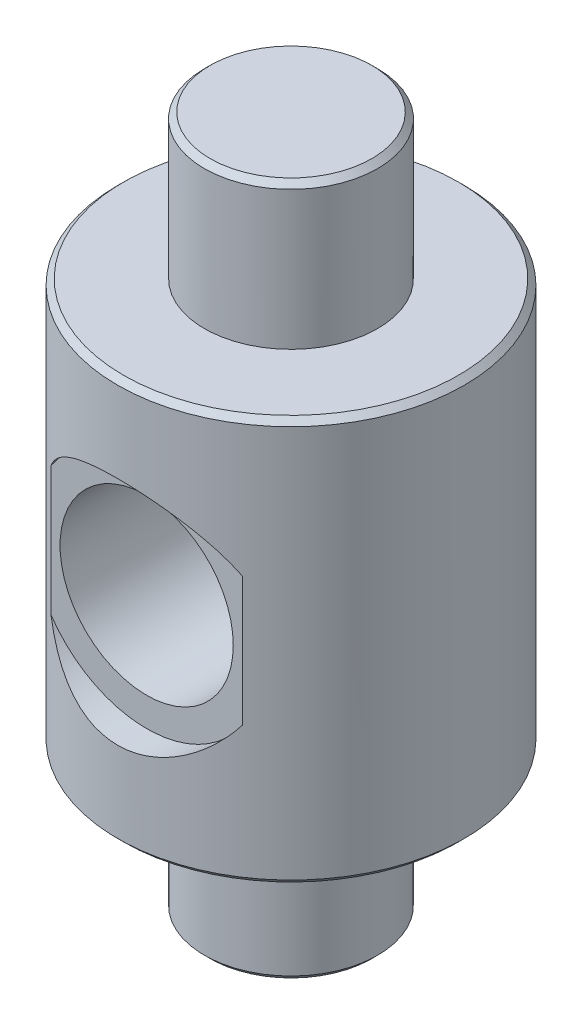
from build123d import *

# Parameters (mm, degrees)
SKETCH2_R          = 2
CUT_EXTRUDE1_DEPTH = 0.5
SKETCH3_R          = 1.5
CUT_EXTRUDE2_DEPTH = 14.536986433
CHAMFER1_SIZE      = 0.1


with BuildPart() as part:
    # Sketch1 → Revolve1 (revolve)
    with BuildSketch(Plane.XY, mode=Mode.PRIVATE) as revolve1_sk:
        Polygon((0, 0), (0, 12), (1.5, 12), (1.5, 9.5), (3, 9.5), (3, 2.5), (1.5, 2.5), (1.5, 0), align=None)
    revolve(revolve1_sk.sketch.rotate(Axis((0, 0, 0), (0, 1, 0)), 90), axis=Axis((0, 0, 0), (0, 1, 0)))

    # Sketch2 → Cut-Extrude1 (cut)
    with BuildSketch(Plane.XY.offset(3)):
        with Locations((0, 6)):
            Circle(SKETCH2_R)
    cut_extrude1 = extrude(amount=-CUT_EXTRUDE1_DEPTH, mode=Mode.SUBTRACT)

    # Mirror1: Cut-Extrude1 across plane
    add(cut_extrude1.mirror(Plane.XY), mode=Mode.SUBTRACT)

    # Sketch3 → Cut-Extrude2 (cut, through all)
    with BuildSketch(Plane.XY.offset(2.5)):
        with Locations((0, 6)):
            Circle(SKETCH3_R)
    extrude(amount=-CUT_EXTRUDE2_DEPTH, mode=Mode.SUBTRACT)

    # Chamfer1
    chamfer1_edges = [part.edges().sort_by_distance(p)[0] for p in [
        (0, 0, 1.5),
        (0, 2.5, 3),
        (0, 9.5, 3),
        (0, 12, 1.5),
    ]]
    chamfer(chamfer1_edges, length=CHAMFER1_SIZE)


solid = part.part
